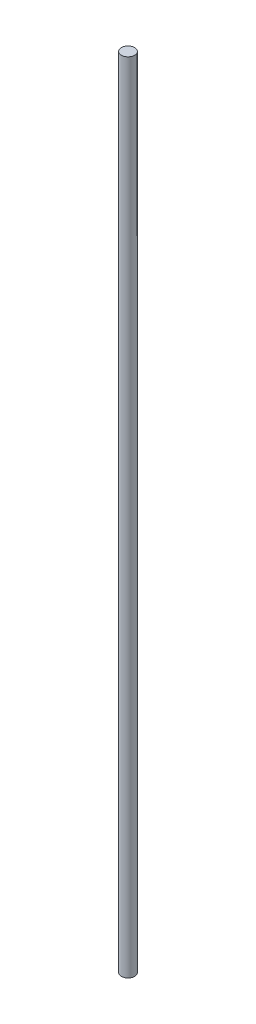
from build123d import *

# Parameters (mm, degrees)
SKETCH1_R           = 3
BOSS_EXTRUDE1_DEPTH = 360


with BuildPart() as part:
    # Sketch1 → Boss-Extrude1 (new body)
    with BuildSketch(Plane(origin=(0, 0, 0), x_dir=(1, 0, 0), z_dir=(0, 1, 0))):
        with Locations(Location((0, 0, 0), (0, 0, 90))):
            Circle(SKETCH1_R)
    extrude(amount=BOSS_EXTRUDE1_DEPTH)


solid = part.part
